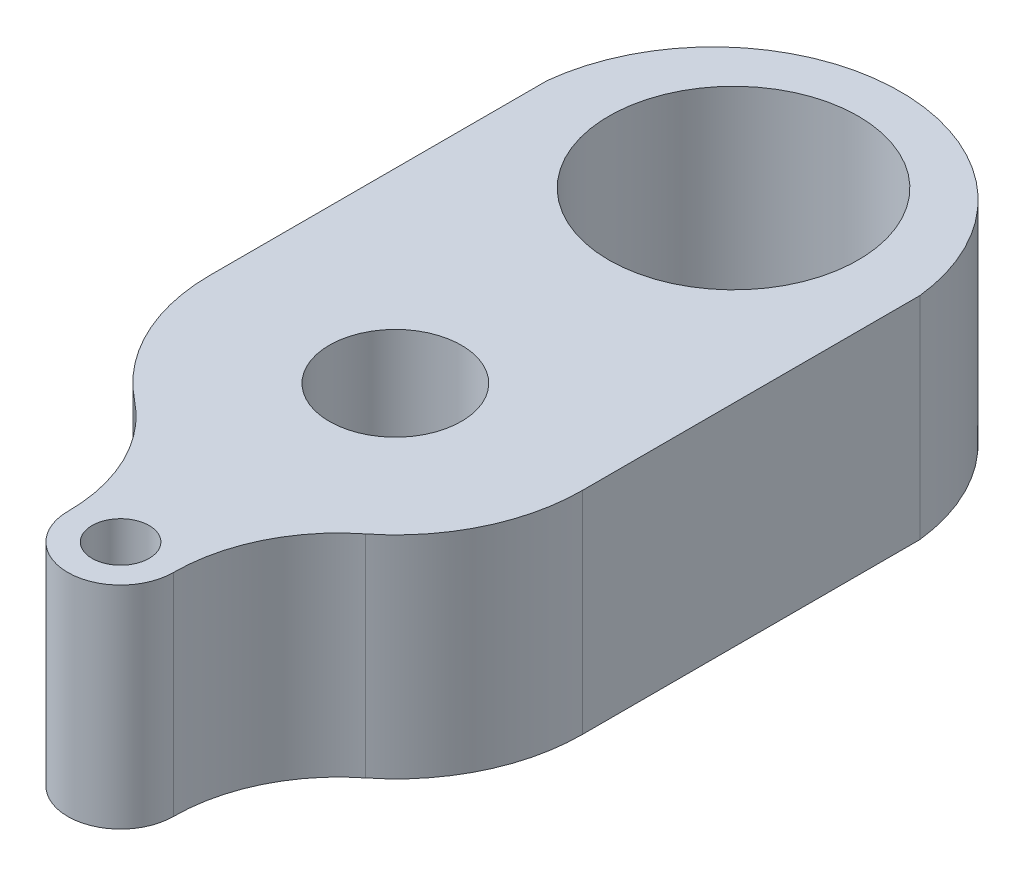
from build123d import *

# Parameters (mm, degrees)
SKETCH1_R           = 0.396875
SKETCH1_R_2         = 0.7493
SKETCH1_R_3         = 0.3175
SKETCH1_R_4         = 0.17145
BOSS_EXTRUDE1_DEPTH = 1.27


with BuildPart() as part:
    # Sketch1 → Boss-Extrude1 (new body)
    # profile 1 of 2: a face of its own
    with BuildSketch(Plane(origin=(0, 0, 0), x_dir=(1, 0, 0), z_dir=(0, 1, 0))):
        with BuildLine():
            ThreePointArc((1.1191875, 0.12258037), (0, 1.12588037), (-1.1191875, 0.12258037))
            Line((-1.1191875, 0.12258037), (-1.1191875, -1.904332965))
            ThreePointArc((-1.1191875, -1.904332965), (-1.007362245, -2.391982396), (-0.694232848, -2.782183415))
            ThreePointArc((-0.694232848, -2.782183415), (-0.416635864, -3.128106305), (-0.3175, -3.56041963))
            ThreePointArc((-0.3175, -3.56041963), (0, -3.24291963), (0.3175, -3.56041963))
            ThreePointArc((0.3175, -3.56041963), (0.416635864, -3.128106305), (0.694232848, -2.782183415))
            ThreePointArc((0.694232848, -2.782183415), (1.007362245, -2.391982396), (1.1191875, -1.904332965))
            Line((1.1191875, -1.904332965), (1.1191875, 0.12258037))
        make_face()
        with Locations(Location((0, -1.90941963, 0), (0, 0, 270))):
            Circle(SKETCH1_R, mode=Mode.SUBTRACT)
        with Locations(Location((0, 0.12258037, 0), (0, 0, 270))):
            Circle(SKETCH1_R_2, mode=Mode.SUBTRACT)
    # profile 2 of 2: a face of its own
    with BuildSketch(Plane(origin=(0, 0, 0), x_dir=(1, 0, 0), z_dir=(0, 1, 0))):
        with Locations((0, -3.56041963)):
            Circle(SKETCH1_R_3)
        with Locations(Location((0, -3.56041963, 0), (0, 0, 270))):
            Circle(SKETCH1_R_4, mode=Mode.SUBTRACT)
    extrude(amount=BOSS_EXTRUDE1_DEPTH)


solid = part.part
